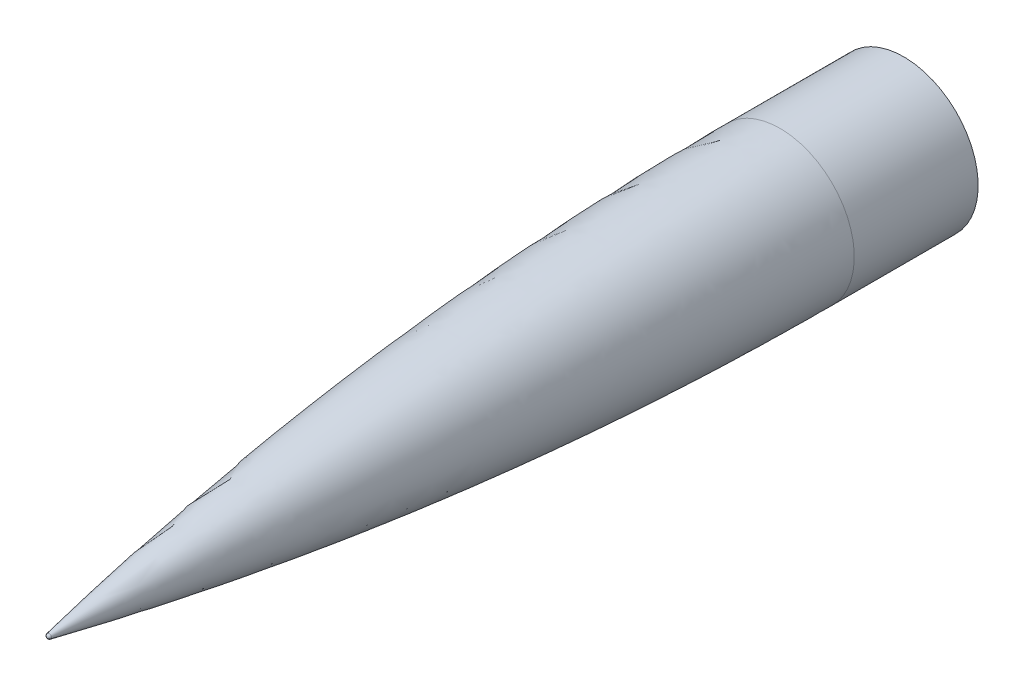
from build123d import *

# Parameters (mm, degrees)
SKETCH4_R           = 76.2
BOSS_EXTRUDE1_DEPTH = 127


with BuildPart() as part:
    # Sketch1 → Revolve1 (revolve)
    with BuildSketch(Plane(origin=(0, 0, 0), x_dir=(0, 0, -1), z_dir=(1, 0, 0))):
        with BuildLine():
            Line((762, 76.2), (762, 0))
            Line((762, 0), (10.392510651, 0))
            ThreePointArc((10.392510651, 0), (10.969312772, 1.611661902), (12.43775009, 2.491347424))
            add(Edge.make_bspline(
                [(12.43775009, 2.491347424), (13.488711327, 2.700059451), (15.606591589, 3.119486806), (20.133531912, 4.013252911), (25.065791341, 4.978768618), (30.062498117, 5.950088372), (35.136465483, 6.929756813), (40.175018448, 7.895397688), (45.223578696, 8.856031422), (50.300363, 9.815006109), (56.696431734, 11.014276098), (63.122586322, 12.207153857), (76.034823982, 14.579737117), (105.755222241, 19.915079038), (179.535050201, 32.433597939), (309.513452378, 51.095369343), (458.506155711, 66.02069447), (592.262717593, 73.29723603), (680.201058154, 75.437050478), (711.04987216, 75.864833243), (716.300850088, 75.929287269), (720.21079081, 75.97372325), (724.092480204, 76.014344218), (728.602410654, 76.056497713), (733.741383178, 76.097661533), (738.8715428, 76.131964829), (744.039048308, 76.159407539), (749.129567884, 76.179989614), (754.154681276, 76.193711018), (758.769681779, 76.198856549), (760.928515032, 76.2), (762, 76.2)],
                knots=[0.082975117, 0.082975117, 0.082975117, 0.082975117, 0.082975117, 0.088656486, 0.094337856, 0.100019225, 0.105700595, 0.111381964, 0.117063334, 0.122744703, 0.128426072, 0.134232612, 0.145845691, 0.151652231, 0.186491469, 0.267783028, 0.476818464, 0.732306217, 0.848437015, 0.860050094, 0.865856634, 0.868759904, 0.871663174, 0.877344543, 0.883025912, 0.888707281, 0.89438865, 0.900070019, 0.905751388, 0.911432757, 0.917114126, 0.917114126, 0.917114126, 0.917114126, 0.917114126], degree=4))
        make_face()
    revolve(axis=Axis((0, 0, -480.06), (0, 0, 1)))

    # Sketch4 → Boss-Extrude1 (add)
    with BuildSketch(Plane(origin=(0, 0, -762), x_dir=(-1, 0, 0), z_dir=(0, 0, -1))):
        Circle(SKETCH4_R)
    extrude(amount=BOSS_EXTRUDE1_DEPTH)


solid = part.part
